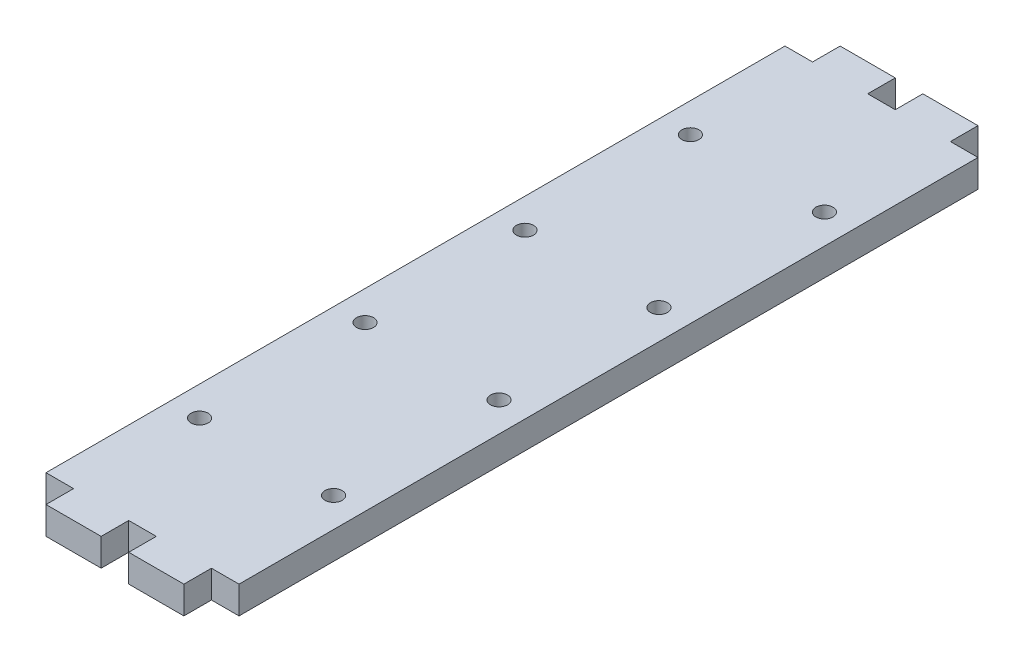
from build123d import *

# Parameters (mm, degrees)
SKETCH1_R           = 1.55
BOSS_EXTRUDE1_DEPTH = 5


with BuildPart() as part:
    # Sketch1 → Boss-Extrude1 (new body)
    with BuildSketch(Plane(origin=(0, 0, 0), x_dir=(1, 0, 0), z_dir=(0, 1, 0))):
        Polygon((-10, -78.788571429), (0, -78.788571429), (0, -73.788571429), (5, -73.788571429), (5, -78.788571429), (15, -78.788571429), (15, -73.788571429), (20, -73.788571429), (20, 60.211428571), (15, 60.211428571), (15, 65.211428571), (5, 65.211428571), (5, 60.211428571), (0, 60.211428571), (0, 65.211428571), (-10, 65.211428571), (-10, 60.211428571), (-15, 60.211428571), (-15, -73.788571429), (-10, -73.788571429), align=None)
        with Locations(Location((14.65, 37.711428571, 0), (0, 0, 270))):
            Circle(SKETCH1_R, mode=Mode.SUBTRACT)
        with Locations(Location((14.65, 7.711428571, 0), (0, 0, 270))):
            Circle(SKETCH1_R, mode=Mode.SUBTRACT)
        with Locations(Location((-9.65, 37.711428571, 0), (0, 0, 270))):
            Circle(SKETCH1_R, mode=Mode.SUBTRACT)
        with Locations(Location((-9.65, 7.711428571, 0), (0, 0, 270))):
            Circle(SKETCH1_R, mode=Mode.SUBTRACT)
        with Locations(Location((-9.65, -21.288571429, 0), (0, 0, 90))):
            Circle(SKETCH1_R, mode=Mode.SUBTRACT)
        with Locations(Location((-9.65, -51.288571429, 0), (0, 0, 90))):
            Circle(SKETCH1_R, mode=Mode.SUBTRACT)
        with Locations(Location((14.65, -21.288571429, 0), (0, 0, 90))):
            Circle(SKETCH1_R, mode=Mode.SUBTRACT)
        with Locations(Location((14.65, -51.288571429, 0), (0, 0, 90))):
            Circle(SKETCH1_R, mode=Mode.SUBTRACT)
    extrude(amount=BOSS_EXTRUDE1_DEPTH)


solid = part.part
